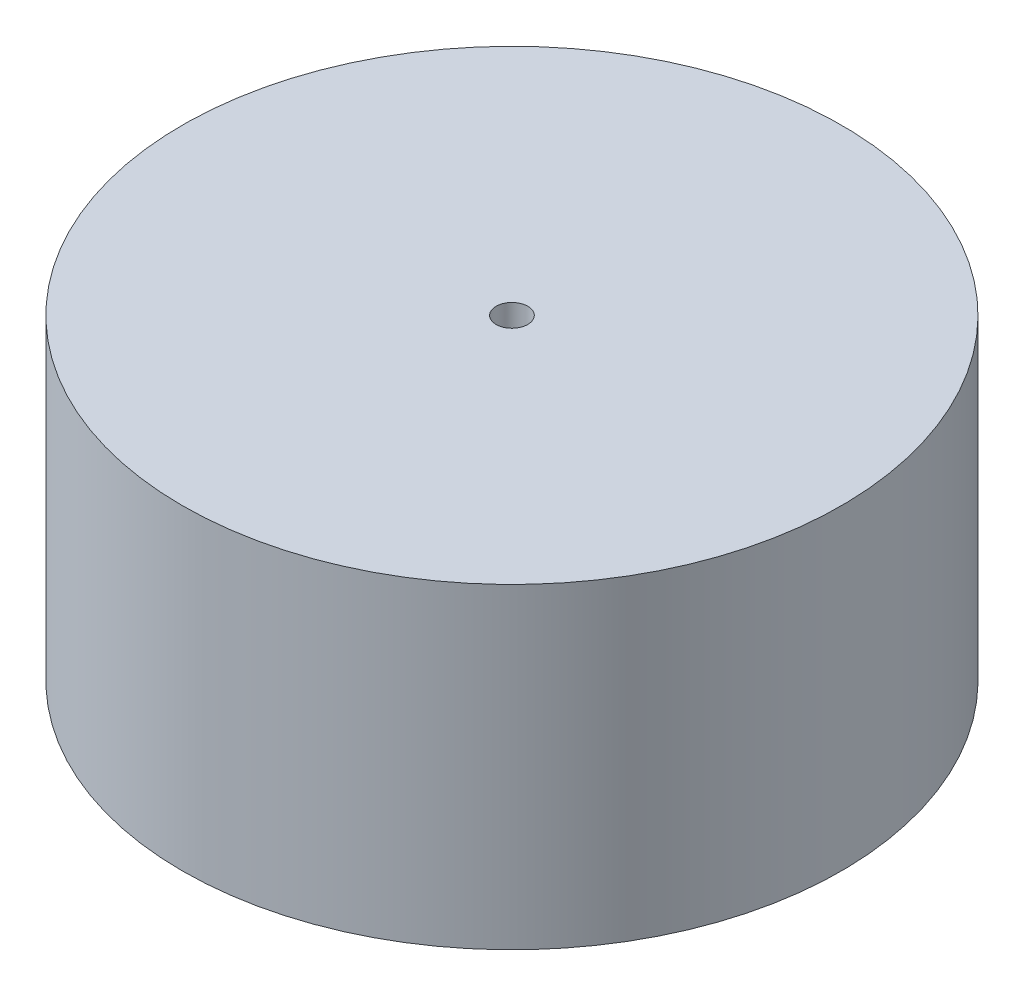
from build123d import *

# Parameters (mm, degrees)
SKETCH1_R           = 62.5
BOSS_EXTRUDE1_DEPTH = 60
SKETCH2_R           = 3
CUT_EXTRUDE1_DEPTH  = 107.829303096


with BuildPart() as part:
    # Sketch1 → Boss-Extrude1 (new body)
    with BuildSketch(Plane(origin=(0, 0, 0), x_dir=(1, 0, 0), z_dir=(0, 1, 0))):
        with Locations(Location((0, 0, 0), (0, 0, 270))):
            Circle(SKETCH1_R)
    extrude(amount=BOSS_EXTRUDE1_DEPTH)

    # Sketch2 → Cut-Extrude1 (cut, through all)
    with BuildSketch(Plane.XZ):
        with Locations(Location((0, 0, 0), (0, 0, 270))):
            Circle(SKETCH2_R)
    extrude(amount=-CUT_EXTRUDE1_DEPTH, mode=Mode.SUBTRACT)


solid = part.part
